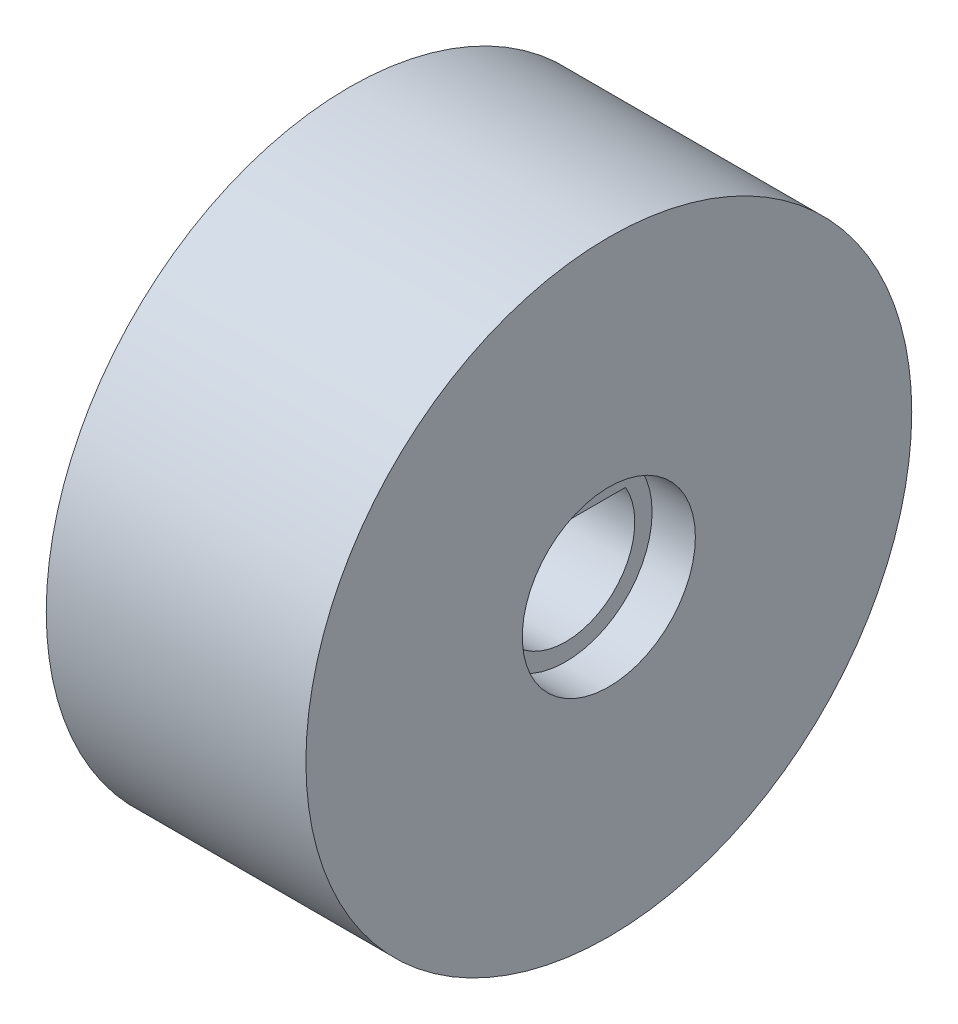
from build123d import *

# Parameters (mm, degrees)
SKETCH1_R           = 35
BOSS_EXTRUDE1_DEPTH = 30
SKETCH2_R           = 10
CUT_EXTRUDE1_DEPTH  = 5
CUT_EXTRUDE2_DEPTH  = 15


with BuildPart() as part:
    # Sketch1 → Boss-Extrude1 (new body)
    with BuildSketch(Plane(origin=(0, 0, 0), x_dir=(0, 0, -1), z_dir=(1, 0, 0))):
        Circle(SKETCH1_R)
    extrude(amount=BOSS_EXTRUDE1_DEPTH)

    # Sketch2 → Cut-Extrude1 (cut)
    with BuildSketch(Plane(origin=(30, 0, 0), x_dir=(0, 0, -1), z_dir=(1, 0, 0))):
        Circle(SKETCH2_R)
    extrude(amount=-CUT_EXTRUDE1_DEPTH, mode=Mode.SUBTRACT)

    # Sketch3 → Cut-Extrude2 (cut)
    with BuildSketch(Plane(origin=(25, 0, 0), x_dir=(0, 0, -1), z_dir=(1, 0, 0))):
        with BuildLine():
            Line((-6.92820323, 4), (6.92820323, 4))
            ThreePointArc((6.92820323, 4), (0, -8), (-6.92820323, 4))
        make_face()
    extrude(amount=-CUT_EXTRUDE2_DEPTH, mode=Mode.SUBTRACT)


solid = part.part
